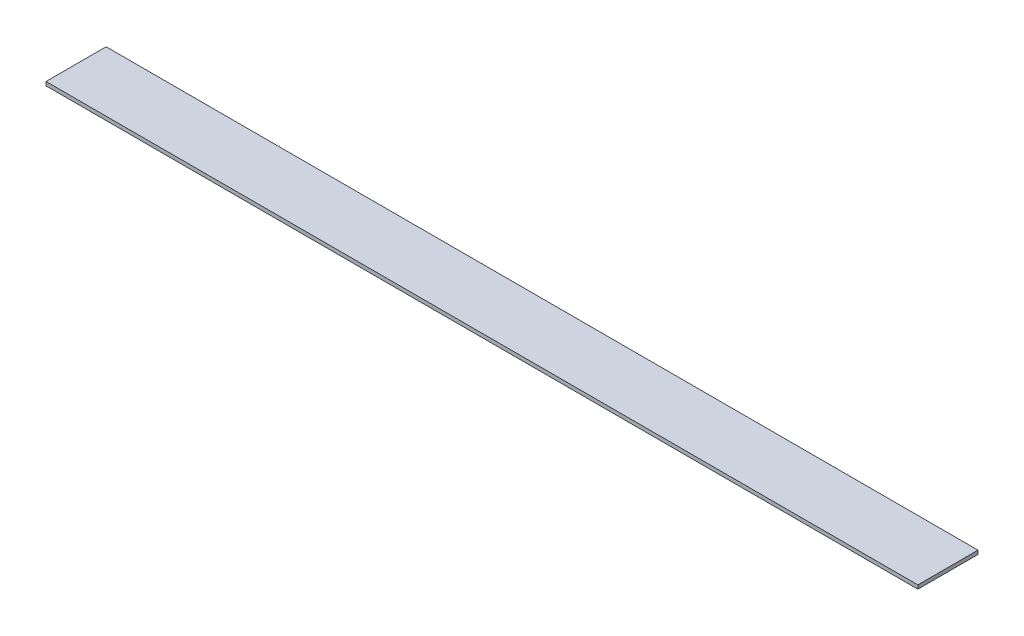
from build123d import *

# Parameters (mm, degrees)
SKETCH1_W           = 368.3
SKETCH1_H           = 25.4
BOSS_EXTRUDE1_DEPTH = 1.5875


with BuildPart() as part:
    # Sketch1 → Boss-Extrude1 (new body)
    with BuildSketch(Plane(origin=(0, 0, 0), x_dir=(1, 0, 0), z_dir=(0, 1, 0))):
        with Locations((184.15, 12.7)):
            Rectangle(SKETCH1_W, SKETCH1_H)
    extrude(amount=BOSS_EXTRUDE1_DEPTH)


solid = part.part
